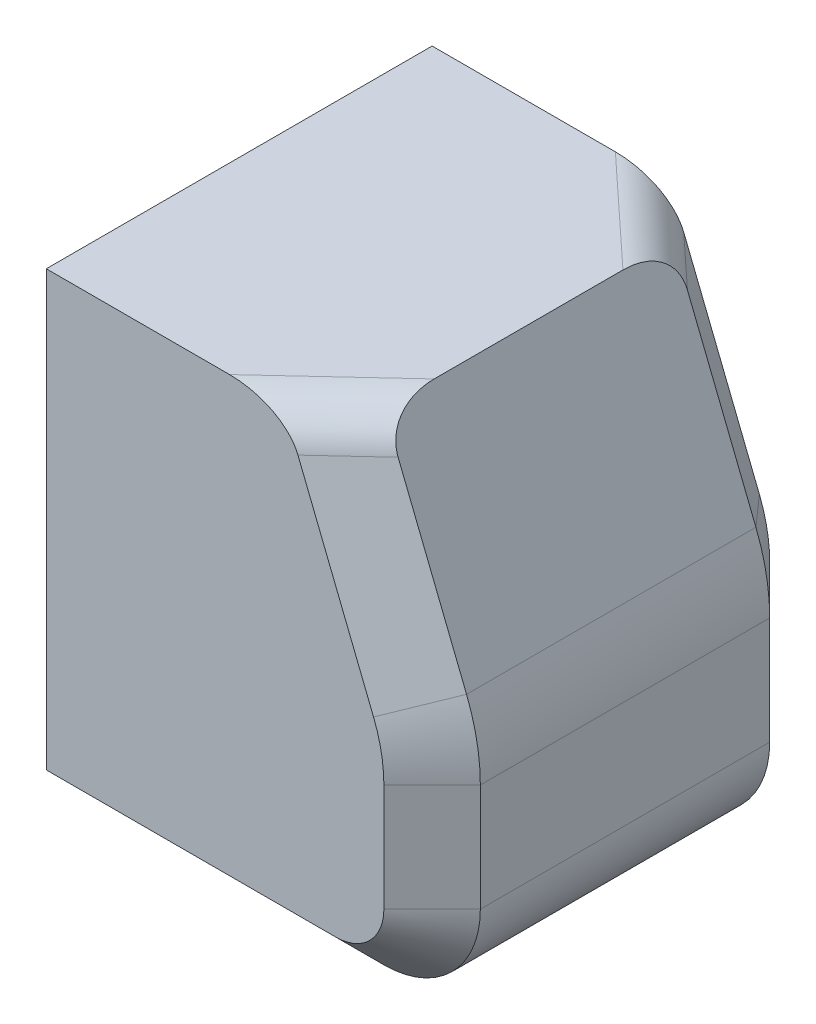
from build123d import *

# Parameters (mm, degrees)
BOSS_EXTRUDE2_DEPTH = 40
CHAMFER2_SIZE       = 5
FILLET2_R           = 5


with BuildPart() as part:
    # Sketch2 → Boss-Extrude2 (new body)
    with BuildSketch(Plane.XY):
        with BuildLine():
            Line((0, 0), (0, 50))
            Line((0, 50), (30, 50))
            Line((30, 50), (38.569533818, 28.576165456))
            ThreePointArc((38.569533818, 28.576165456), (39.639127735, 24.930502352), (40, 21.148351929))
            Line((40, 21.148351929), (40, 10))
            ThreePointArc((40, 10), (37.071067812, 2.928932188), (30, 0))
            Line((30, 0), (0, 0))
        make_face()
    extrude(amount=BOSS_EXTRUDE2_DEPTH)

    # Chamfer2
    chamfer2_edges = [part.edges().sort_by_distance(p)[0] for p in [
        (15, 0, 0),
        (40, 15.574175964, 40),
        (39.639127735, 24.930502352, 40),
        (34.284766909, 39.288082728, 40),
        (15, 0, 40),
        (34.284766909, 39.288082728, 0),
        (39.639127735, 24.930502352, 0),
        (37.071067812, 2.928932188, 40),
        (40, 15.574175964, 0),
        (37.071067812, 2.928932188, 0),
    ]]
    chamfer(chamfer2_edges, length=CHAMFER2_SIZE)

    # Fillet2
    fillet2_edges = [part.edges().sort_by_distance(p)[0] for p in [
        (27.307417596, 50, 37.5),
        (27.307417596, 50, 2.5),
    ]]
    fillet(fillet2_edges, radius=FILLET2_R)


solid = part.part
